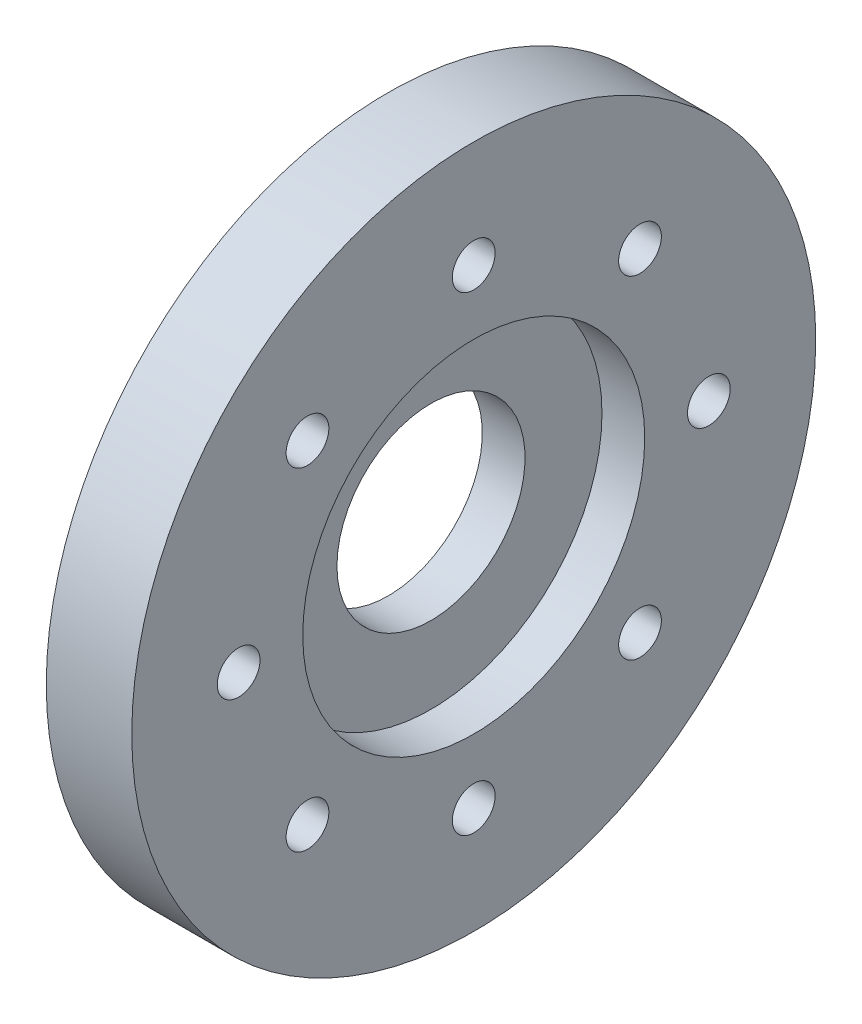
from build123d import *

# Parameters (mm, degrees)
SKETCH2_R          = 2.5
CUT_EXTRUDE1_DEPTH = 58.445626465


with BuildPart() as part:
    # Sketch1 → Revolve1 (revolve)
    with BuildSketch(Plane.XY, mode=Mode.PRIVATE) as revolve1_sk:
        Polygon((2.55, 20), (2.55, 40), (-7.45, 40), (-7.45, 11), (-2.45, 11), (-2.45, 20), align=None)
    revolve(revolve1_sk.sketch.rotate(Axis((-7.45, 0, 0), (1, 0, 0)), 90), axis=Axis((-7.45, 0, 0), (1, 0, 0)))

    # Sketch2 → Cut-Extrude1 (cut, through all)
    with BuildSketch(Plane(origin=(2.55, 0, 0), x_dir=(0, 0, -1), z_dir=(1, 0, 0))):
        with Locations((-19.445436483, -19.445436483)):
            Circle(SKETCH2_R)
        with Locations((-27.5, 0)):
            Circle(SKETCH2_R)
        with Locations((-19.445436483, 19.445436483)):
            Circle(SKETCH2_R)
        with Locations((0, 27.5)):
            Circle(SKETCH2_R)
        with Locations((19.445436483, 19.445436483)):
            Circle(SKETCH2_R)
        with Locations((27.5, 0)):
            Circle(SKETCH2_R)
        with Locations((19.445436483, -19.445436483)):
            Circle(SKETCH2_R)
        with Locations((0, -27.5)):
            Circle(SKETCH2_R)
    extrude(amount=-CUT_EXTRUDE1_DEPTH, mode=Mode.SUBTRACT)


solid = part.part
